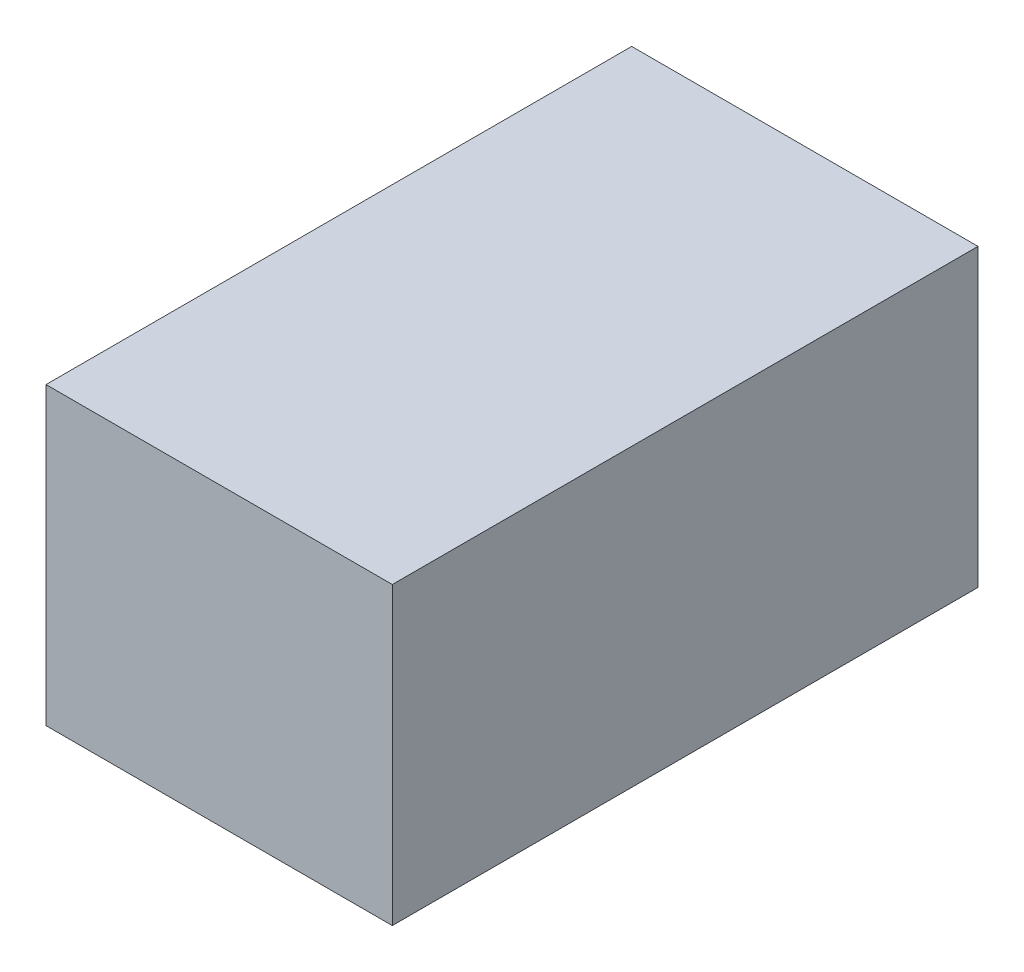
from build123d import *

# Parameters (mm, degrees)
SKETCH1_W           = 68
SKETCH1_H           = 115
BOSS_EXTRUDE1_DEPTH = 58


with BuildPart() as part:
    # Sketch1 → Boss-Extrude1 (new body)
    with BuildSketch(Plane(origin=(0, 0, 0), x_dir=(1, 0, 0), z_dir=(0, 1, 0))):
        Rectangle(SKETCH1_W, SKETCH1_H)
    extrude(amount=BOSS_EXTRUDE1_DEPTH)


solid = part.part
